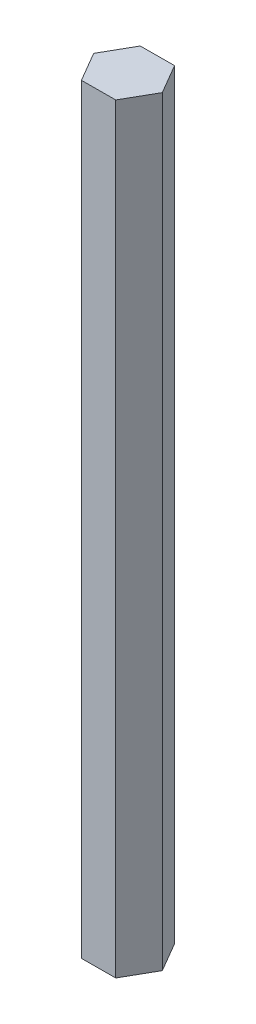
from build123d import *

# Parameters (mm, degrees)
SALIENTE_EXTRUIR1_DEPTH = 116
SALIENTE_EXTRUIR3_DEPTH = 47.28


with BuildPart() as part:
    # Croquis1 → Saliente-Extruir1 (new body)
    with BuildSketch(Plane(origin=(0, 0, 0), x_dir=(1, 0, 0), z_dir=(0, 1, 0))):
        Polygon((-3.632503467, -6.369321148), (3.699742186, -6.330500856), (7.332245653, 0.038820292), (3.632503467, 6.369321148), (-3.699742186, 6.330500856), (-7.332245653, -0.038820292), align=None)
    extrude(amount=SALIENTE_EXTRUIR1_DEPTH)

    # Croquis6 → Saliente-Extruir3 (add)
    with BuildSketch(Plane.XZ):
        Polygon((7.332245653, -0.038820292), (3.699742186, 6.330500856), (-3.632503467, 6.369321148), (-7.332245653, 0.038820292), (-3.699742186, -6.330500856), (3.632503467, -6.369321148), align=None)
    extrude(amount=SALIENTE_EXTRUIR3_DEPTH)


solid = part.part
